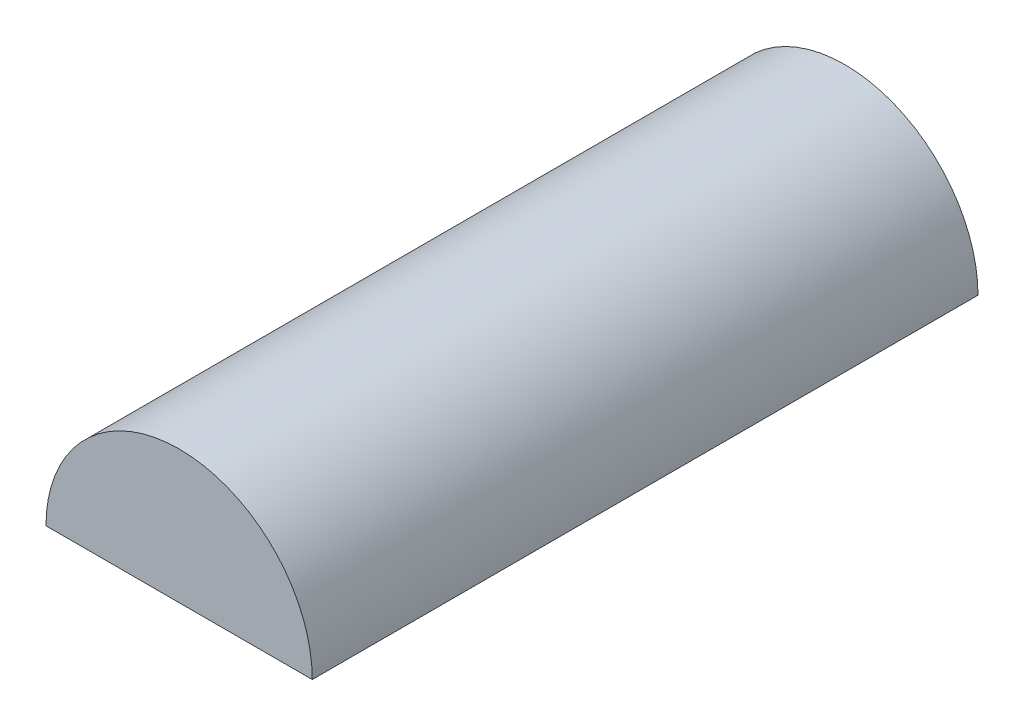
from build123d import *

# Parameters (mm, degrees)
BOSS_EXTRUDE1_DEPTH = 500


with BuildPart() as part:
    # Sketch1 → Boss-Extrude1 (new body)
    with BuildSketch(Plane.XY):
        with BuildLine():
            Line((-100, 0), (100, 0))
            ThreePointArc((100, 0), (0, 100), (-100, 0))
        make_face()
    extrude(amount=BOSS_EXTRUDE1_DEPTH)


solid = part.part
